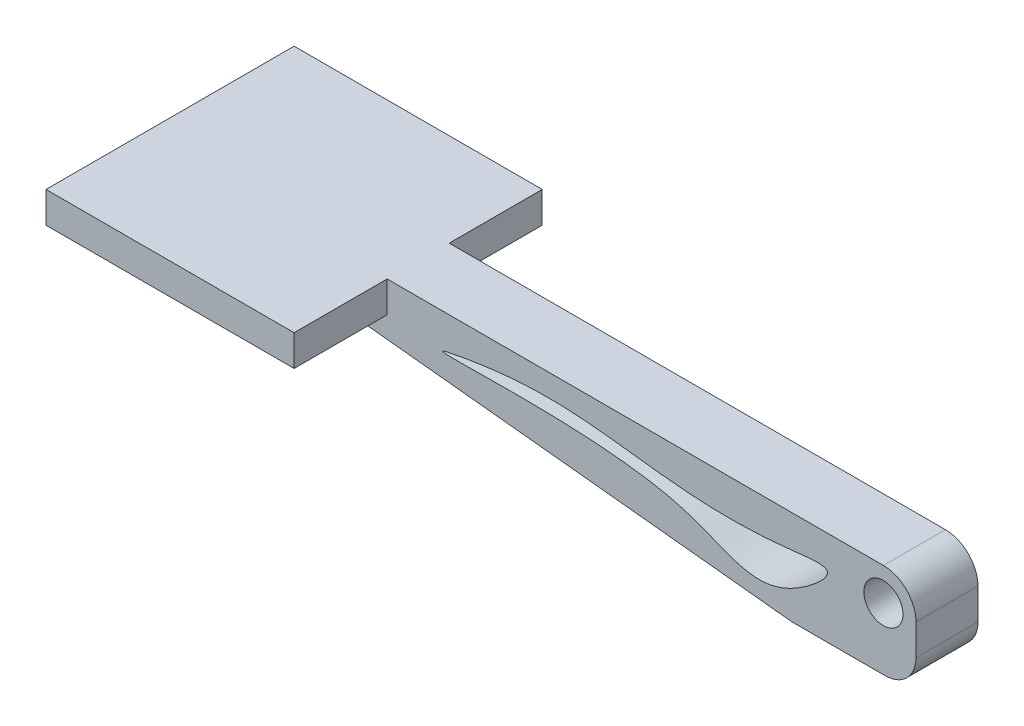
from build123d import *

# Parameters (mm, degrees)
BOSS_EXTRUDE2_DEPTH      = 10
BOSS_EXTRUDE2_DEPTH_BACK = 10
SKETCH1_R                = 6.3
BOSS_EXTRUDE5_DEPTH      = 10


with BuildPart() as part:
    # Sketch1 → Boss-Extrude2 (new, two sides: drawn at the far end of the back side and taken through both)
    with BuildSketch(Plane.XY.offset(-BOSS_EXTRUDE2_DEPTH_BACK)):
        with BuildLine():
            Line((-232.485951852, -2.205597272), (-201.010392048, -2.205597272))
            ThreePointArc((-201.010392048, -2.205597272), (-199.970780015, -2.232635378), (-198.933978895, -2.31367659))
            Line((-198.933978895, -2.31367659), (-29.5, -20))
            Line((-29.5, -20), (0.5, -20))
            ThreePointArc((0.5, -20), (7.571067812, -17.071067812), (10.5, -10))
            Line((10.5, -10), (10.5, 0))
            ThreePointArc((10.5, 0), (7.424621202, 7.424621202), (0, 10.5))
            Line((0, 10.5), (-199.969372655, 10.5))
            Line((-199.969372655, 10.5), (-239.985951852, 10.5))
            Line((-239.985951852, 10.5), (-239.985951852, 5.294402728))
            ThreePointArc((-239.985951852, 5.294402728), (-237.789252711, -0.008898131), (-232.485951852, -2.205597272))
        make_face()
        with BuildLine():
            add(Edge.make_bspline(
                [(-29.5, 0), (-71.215452784, -4.618921443), (-91.249553359, 8.295604419), (-167.314221678, -4.516378239), (-66.660462753, 5.705990527), (-39.354743787, -20.82364873), (-11.877374637, 2.389635503), (-24.523342717, 0.551037745), (-29.5, 0)],
                knots=[0, 0, 0, 0, 0.381705307, 0.445280413, 0.748987596, 0.89187549, 0.954462522, 1, 1, 1, 1], degree=3))
        make_face(mode=Mode.SUBTRACT)
        Circle(SKETCH1_R, mode=Mode.SUBTRACT)
    extrude(amount=BOSS_EXTRUDE2_DEPTH + BOSS_EXTRUDE2_DEPTH_BACK)

    # Sketch2 → Boss-Extrude5 (add)
    with BuildSketch(Plane(origin=(0, 10.5, 0), x_dir=(1, 0, 0), z_dir=(0, 1, 0))):
        Polygon((-240, 40), (-240, -40), (-160, -40), (-160, 0), (-160, 40), align=None)
    extrude(amount=-BOSS_EXTRUDE5_DEPTH)


solid = part.part
